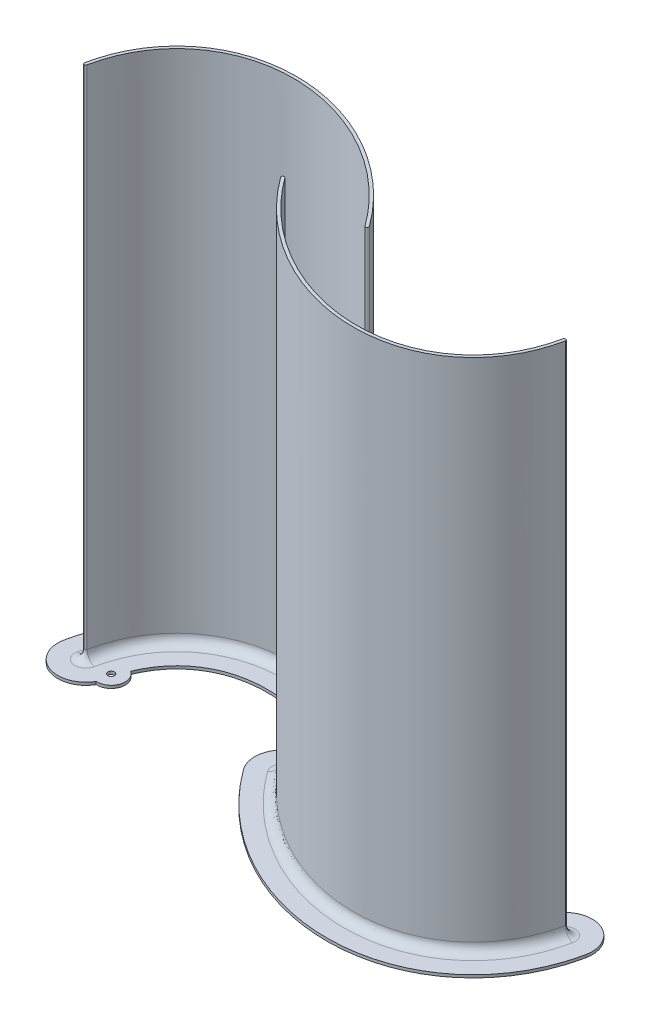
from build123d import *

# Parameters (mm, degrees)
BLADE_DEPTH          = 550
BASE_PROFILE_R       = 44.999999998
BASE_PROFILE_R_2     = 15
BASE_DEPTH           = 3
M6_CLEARANCE_HOLE1_D = 7
SUPPORT_R            = 10
BLADE_2_COUNT        = 2


with BuildPart() as part:
    # Blade Profile → Blade (new body)
    with BuildSketch(Plane(origin=(0, 0, 0), x_dir=(1, 0, 0), z_dir=(0, 1, 0))):
        with BuildLine():
            ThreePointArc((46.334440009, 0.970448279), (45.970448279, -1.334440009), (43.665559991, -0.970448279))
            add(Edge.make_bspline(
                [(43.665559991, -0.970448279), (40.993985094, 2.703169888), (35.459938583, 9.902441733), (23.600413772, 23.751002968), (0.972425119, 46.294913315), (-35.81119286, 72.737380356), (-83.669975669, 92.778338517), (-131.531251442, 99.617645638), (-168.330160082, 93.916717806), (-194.249513155, 82.824486694), (-211.572791183, 71.416452276), (-226.456323551, 57.132684089), (-236.594673608, 43.055398468), (-243.231360001, 30.645687215), (-247.447934583, 20.810054178), (-250.310973869, 12.206938895), (-252.200061393, 5.115866523), (-253.013431301, 1.486389775), (-253.383186282, -0.329261902)],
                knots=[-1.719204357, -1.719204357, -1.719204357, -1.719204357, -1.649735682, -1.580267007, -1.441329658, -1.163454958, -0.885580258, -0.607705559, -0.329830859, -0.190893509, -0.051956159, 0.086981191, 0.22591854, 0.295387215, 0.36485589, 0.434324565, 0.469058903, 0.50379324, 0.50379324, 0.50379324, 0.50379324], degree=3))
            ThreePointArc((-253.383186282, -0.329261902), (-255.329261902, -1.616813718), (-256.616813718, 0.329261902))
            add(Edge.make_bspline(
                [(46.334440009, 0.970448279), (43.62856316, 4.691234233), (38.023245901, 11.983216596), (26.012793786, 26.007977277), (3.096883266, 48.83873489), (-34.169234521, 75.631594716), (-82.748922312, 95.983430266), (-131.504155308, 102.965659143), (-169.183508969, 97.14376525), (-195.814854507, 85.749660341), (-213.641418095, 74.011394121), (-228.964044068, 59.306035188), (-239.392574871, 44.823939078), (-246.210289936, 32.075007954), (-250.537248121, 21.981202907), (-253.471636296, 13.163024763), (-255.406196193, 5.900977523), (-256.23840562, 2.187404009), (-256.616813718, 0.329261902)],
                knots=[-1.719204357, -1.719204357, -1.719204357, -1.719204357, -1.649735682, -1.580267007, -1.441329658, -1.163454958, -0.885580258, -0.607705559, -0.329830859, -0.190893509, -0.051956159, 0.086981191, 0.22591854, 0.295387215, 0.36485589, 0.434324565, 0.469058903, 0.50379324, 0.50379324, 0.50379324, 0.50379324], degree=3))
        make_face()
    extrude(amount=BLADE_DEPTH)

    # Base profile → Base (add)
    with BuildSketch(Plane(origin=(0, 0, 0), x_dir=(1, 0, 0), z_dir=(0, 1, 0))):
        Circle(BASE_PROFILE_R)
        with Locations((-228.035085, 0)):
            Circle(BASE_PROFILE_R_2)
        with BuildLine():
            ThreePointArc((69.262545614, 17.644514171), (62.644514171, -24.262545614), (20.737454386, -17.644514171))
            add(Edge.make_bspline(
                [(20.737454386, -17.644514171), (18.360564437, -14.376110164), (13.438798442, -7.973305954), (2.875876377, 4.361541861), (-17.278601688, 24.441173421), (-49.917107682, 47.873447899), (-91.582661326, 65.243686676), (-131.764031863, 70.855165984), (-160.999117368, 66.193446577), (-180.801807907, 57.694585822), (-193.801405441, 49.123542795), (-204.912724563, 38.461622373), (-212.558158212, 27.862026864), (-217.639643738, 18.366522684), (-220.907922829, 10.748821923), (-223.158010287, 3.993292122), (-224.656448796, -1.6289507), (-225.307970109, -4.535959785), (-225.603386939, -5.986580038)],
                knots=[-1.719204357, -1.719204357, -1.719204357, -1.719204357, -1.649735682, -1.580267007, -1.441329658, -1.163454958, -0.885580258, -0.607705559, -0.329830859, -0.190893509, -0.051956159, 0.086981191, 0.22591854, 0.295387215, 0.36485589, 0.434324565, 0.469058903, 0.50379324, 0.50379324, 0.50379324, 0.50379324], degree=3))
            ThreePointArc((-225.603386939, -5.986580038), (-260.986580038, -29.396613061), (-284.396613061, 5.986580038))
            add(Edge.make_bspline(
                [(69.262545614, 17.644514171), (57.269306999, 34.136127153), (29.633170902, 64.731121888), (-20.064127597, 100.495726265), (-74.83601994, 123.518028154), (-131.271433852, 131.728155516), (-176.514545558, 124.867028495), (-209.262558986, 110.879572242), (-231.412811697, 96.30426272), (-250.507612385, 77.977249403), (-263.429180845, 60.016861837), (-271.801849296, 44.354949905), (-277.077858781, 32.039467756), (-281.331829155, 19.254611013), (-283.49321351, 10.422649857), (-284.396613061, 5.986580038)],
                knots=[-1.719204357, -1.719204357, -1.719204357, -1.719204357, -1.441329658, -1.163454958, -0.885580258, -0.607705559, -0.329830859, -0.190893509, -0.051956159, 0.086981191, 0.22591854, 0.295387215, 0.36485589, 0.434324565, 0.50379324, 0.50379324, 0.50379324, 0.50379324], degree=3))
        make_face()
    extrude(amount=-BASE_DEPTH)

    # M6 Clearance Hole1 (through all)
    with Locations(Plane(origin=(0, 0, 0), x_dir=(1, 0, 0), z_dir=(0, 1, 0))):
        with Locations((-228.035085, 0)):
            Hole(M6_CLEARANCE_HOLE1_D / 2)

    # Support
    support_edges = [part.edges().sort_by_distance(p)[0] for p in [
        (45.970448279, 0, 1.334440009),
        (-255.329261902, 0, 1.616813718),
    ]]
    fillet(support_edges, radius=SUPPORT_R)


with BuildPart() as blade_2_1:
    # Blade 2: pattern copy
    add(part.part.rotate(Axis((0, 0, 0), (0, 1, 0)), 1 * 360 / BLADE_2_COUNT))


with BuildPart() as part_1:
    add(part.part)

    # Savonious: union Blade 2_1
    add(blade_2_1.part)


solid = part_1.part
